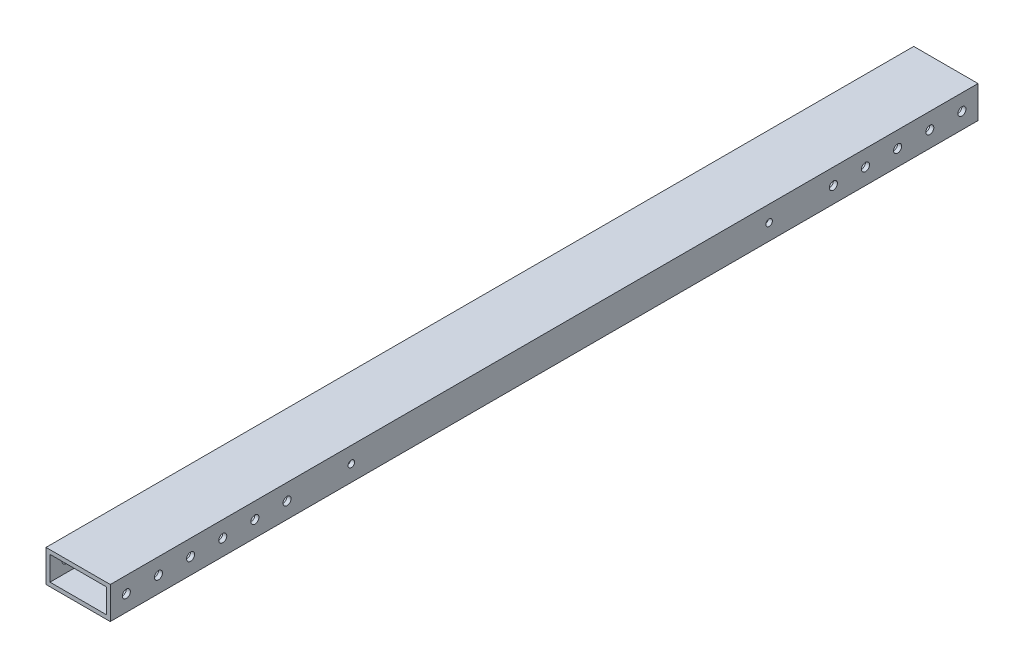
from build123d import *

# Parameters (mm, degrees)
BOSS_EXTRUDE1_DEPTH              = 342.9
BOSS_EXTRUDE1_DEPTH_BACK         = 342.9
SKETCH3_W                        = 50.8
SKETCH3_H                        = 25.4
SKETCH3_W_2                      = 44.45
SKETCH3_H_2                      = 19.05
F_1_4_0_25_DIAMETER_HOLE3_D      = 6.35
F_1_4_0_25_DIAMETER_HOLE4_D      = 6.35
F_1_4_0_25_DIAMETER_HOLE5_D      = 6.35
F_1_4_0_25_DIAMETER_HOLE6_D      = 6.35
F_1_4_0_25_DIAMETER_HOLE7_D      = 6.35
F_1_4_0_25_DIAMETER_HOLE8_D      = 6.35
F_13_64_0_20313_DIAMETER_HOLE1_D = 5.159502
F_1_2_0_5_DIAMETER_HOLE1_D       = 12.7
F_1_2_0_5_DIAMETER_HOLE1_DEPTH   = 6.35
F_1_2_0_5_DIAMETER_HOLE1_TIP     = 3.815464931


with BuildPart() as part:
    # Sketch3 → Boss-Extrude1 (new, two sides: drawn at the far end of the back side and taken through both)
    with BuildSketch(Plane.XY.offset(-BOSS_EXTRUDE1_DEPTH_BACK)):
        Rectangle(SKETCH3_W, SKETCH3_H)
        Rectangle(SKETCH3_W_2, SKETCH3_H_2, mode=Mode.SUBTRACT)
    extrude(amount=BOSS_EXTRUDE1_DEPTH + BOSS_EXTRUDE1_DEPTH_BACK)

    # 1/4 (0.25) Diameter Hole3 (through all)
    with Locations(Plane.ZY.offset(25.4)):
        with Locations((-330.2, 0)):
            Hole(F_1_4_0_25_DIAMETER_HOLE3_D / 2)

    # 1/4 (0.25) Diameter Hole4 (through all)
    with Locations(Plane.ZY.offset(25.4)):
        with Locations((304.8, 0), (330.2, 0)):
            Hole(F_1_4_0_25_DIAMETER_HOLE4_D / 2)

    # 1/4 (0.25) Diameter Hole5 (through all)
    with Locations(Plane(origin=(25.4, 0, 0), x_dir=(0, 0, -1), z_dir=(1, 0, 0))):
        with Locations((304.8, 0), (279.4, 0)):
            Hole(F_1_4_0_25_DIAMETER_HOLE5_D / 2)

    # 1/4 (0.25) Diameter Hole6 (through all)
    with Locations(Plane(origin=(25.4, 0, 0), x_dir=(0, 0, -1), z_dir=(1, 0, 0))):
        with Locations((228.6, 0), (254, 0)):
            Hole(F_1_4_0_25_DIAMETER_HOLE6_D / 2)

    # 1/4 (0.25) Diameter Hole7 (through all)
    with Locations(Plane(origin=(25.4, 0, 0), x_dir=(0, 0, -1), z_dir=(1, 0, 0))):
        with Locations((-203.2, 0), (-228.6, 0)):
            Hole(F_1_4_0_25_DIAMETER_HOLE7_D / 2)

    # 1/4 (0.25) Diameter Hole8 (through all)
    with Locations(Plane(origin=(25.4, 0, 0), x_dir=(0, 0, -1), z_dir=(1, 0, 0))):
        with Locations((-279.4, 0), (-254, 0)):
            Hole(F_1_4_0_25_DIAMETER_HOLE8_D / 2)

    # 13/64 (0.20313) Diameter Hole1 (through all)
    with Locations(Plane(origin=(25.4, 0, 0), x_dir=(0, 0, -1), z_dir=(1, 0, 0))):
        with Locations((-152.4, 0), (177.8, 0)):
            Hole(F_13_64_0_20313_DIAMETER_HOLE1_D / 2)

    # 1/2 (0.5) Diameter Hole1
    with Locations(Plane.ZY.offset(25.4)):
        with Locations((-128.5875, 1.016e-06), (-103.1875, 1.016e-06), (77.7875, 1.016e-06), (103.1875, 1.016e-06)):
            Hole(F_1_2_0_5_DIAMETER_HOLE1_D / 2, depth=F_1_2_0_5_DIAMETER_HOLE1_DEPTH)
            with Locations((0, 0, -(F_1_2_0_5_DIAMETER_HOLE1_DEPTH + F_1_2_0_5_DIAMETER_HOLE1_TIP / 2))):  # 118° drill point
                Cone(0, F_1_2_0_5_DIAMETER_HOLE1_D / 2, F_1_2_0_5_DIAMETER_HOLE1_TIP, mode=Mode.SUBTRACT)


solid = part.part
